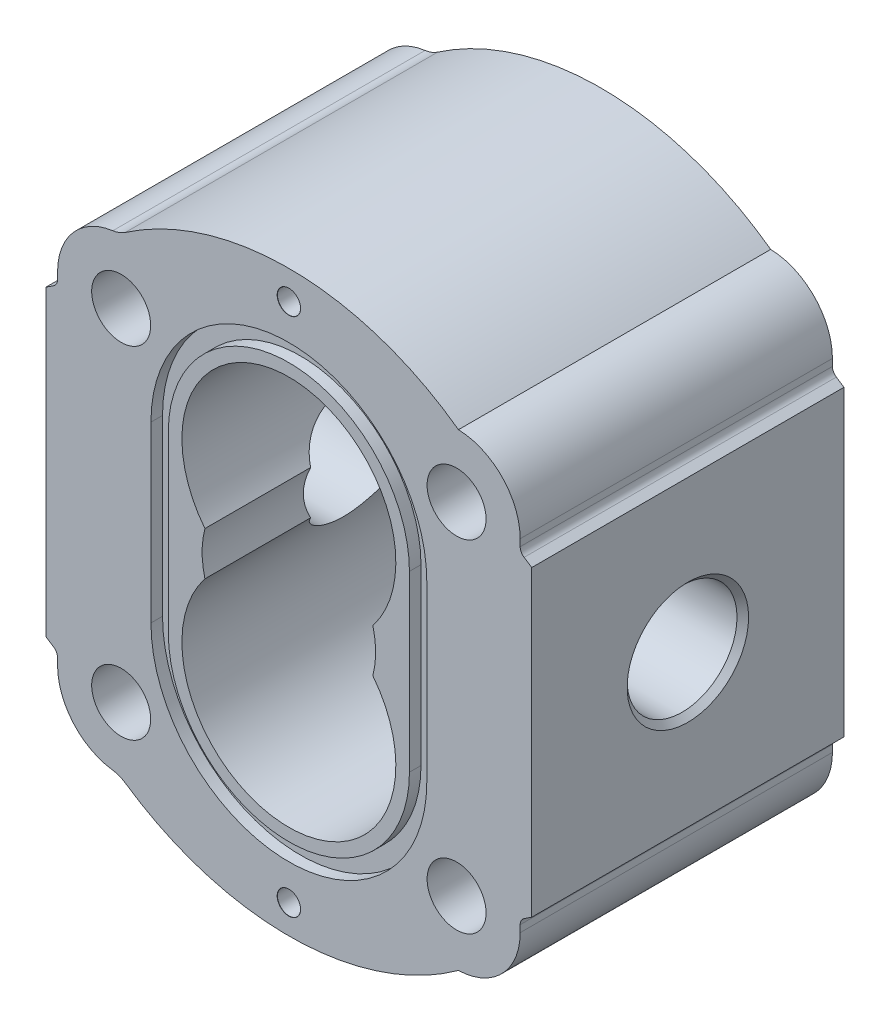
from build123d import *

# Parameters (mm, degrees)
IZIM1_R                       = 5.1
Y_KSEKLIK_EKSTR_ZYON1_DEPTH   = 27
KES_EKSTR_ZYON2_DEPTH         = 2
G1_2_DI_LI_DELIK1_D           = 19
G1_2_DI_LI_DELIK1_DEPTH       = 47.35
G1_2_DI_LI_DELIK1_CSINK_D     = 21.005
G1_2_DI_LI_DELIK1_CSINK_ANGLE = 90
G1_2_DI_LI_DELIK1_TIP         = 5.708175881
G1_2_DI_LI_DELIK2_D           = 19
G1_2_DI_LI_DELIK2_DEPTH       = 37.35
G1_2_DI_LI_DELIK2_CSINK_D     = 21.005
G1_2_DI_LI_DELIK2_CSINK_ANGLE = 90
G1_2_DI_LI_DELIK2_TIP         = 5.708175881
F_4_0_4_AP_DELIK1_AT_2_COUNT  = 2
F_4_0_4_AP_DELIK1_AT_2_PITCH  = 90
KES_EKSTR_ZYON3_DEPTH         = 2


with BuildPart() as part:
    # Çizim1 → Yükseklik-Ekstrüzyon1 (new, symmetric)
    with BuildSketch(Plane.XY):
        with BuildLine():
            ThreePointArc((-30.445342697, 40.404631332), (-37.273414339, 36.74918031), (-40, 29.5))
            Line((-40, 29.5), (-40, 28.305972781))
            ThreePointArc((-40, 28.305972781), (-40.180221035, 27.593102888), (-40.677577979, 27.051531862))
            Line((-40.677577979, 27.051531862), (-42, 26.184540858))
            Line((-42, 26.184540858), (-42, -26.184540858))
            Line((-42, -26.184540858), (-40.677577979, -27.051531862))
            ThreePointArc((-40.677577979, -27.051531862), (-40.180221035, -27.593102888), (-40, -28.305972781))
            Line((-40, -28.305972781), (-40, -29.5))
            ThreePointArc((-40, -29.5), (-37.273414339, -36.74918031), (-30.445342697, -40.404631332))
            ThreePointArc((-30.445342697, -40.404631332), (-29.311006992, -40.693176357), (-28.274833318, -41.237529034))
            ThreePointArc((-28.274833318, -41.237529034), (0, -50), (28.274833318, -41.237529034))
            ThreePointArc((28.274833318, -41.237529034), (28.803938458, -40.86970919), (29.328259336, -40.495100991))
            ThreePointArc((29.328259336, -40.495100991), (29.887953959, -40.464102233), (30.445342697, -40.404631332))
            ThreePointArc((30.445342697, -40.404631332), (37.273414339, -36.74918031), (40, -29.5))
            Line((40, -29.5), (40, -28.305972781))
            ThreePointArc((40, -28.305972781), (40.180221035, -27.593102888), (40.677577979, -27.051531862))
            Line((40.677577979, -27.051531862), (42, -26.184540858))
            Line((42, -26.184540858), (42, 26.184540858))
            Line((42, 26.184540858), (40.677577979, 27.051531862))
            ThreePointArc((40.677577979, 27.051531862), (40.180221035, 27.593102888), (40, 28.305972781))
            Line((40, 28.305972781), (40, 29.5))
            ThreePointArc((40, 29.5), (37.273414339, 36.74918031), (30.445342697, 40.404631332))
            ThreePointArc((30.445342697, 40.404631332), (29.887953959, 40.464102233), (29.328259336, 40.495100991))
            ThreePointArc((29.328259336, 40.495100991), (28.803938458, 40.86970919), (28.274833318, 41.237529034))
            ThreePointArc((28.274833318, 41.237529034), (0, 50), (-28.274833318, 41.237529034))
            ThreePointArc((-28.274833318, 41.237529034), (-29.311006992, 40.693176357), (-30.445342697, 40.404631332))
        make_face()
        with Locations((-29, -29.5)):
            Circle(IZIM1_R, mode=Mode.SUBTRACT)
        with Locations((29, -29.5)):
            Circle(IZIM1_R, mode=Mode.SUBTRACT)
        with Locations((-29, 29.5)):
            Circle(IZIM1_R, mode=Mode.SUBTRACT)
        with BuildLine():
            ThreePointArc((14.519627513, -3.765689429), (0, -33.73), (-14.519627513, -3.765689429))
            ThreePointArc((-14.519627513, -3.765689429), (-15, 0), (-14.519627513, 3.765689429))
            ThreePointArc((-14.519627513, 3.765689429), (0, 33.73), (14.519627513, 3.765689429))
            ThreePointArc((14.519627513, 3.765689429), (15, 0), (14.519627513, -3.765689429))
        make_face(mode=Mode.SUBTRACT)
        with Locations((29, 29.5)):
            Circle(IZIM1_R, mode=Mode.SUBTRACT)
    extrude(amount=Y_KSEKLIK_EKSTR_ZYON1_DEPTH, both=True)

    # Çizim2 → Kes-Ekstrüzyon2 (cut)
    with BuildSketch(Plane.XY.offset(27)):
        with BuildLine():
            Line((23.85, 15.04), (23.85, -15.04))
            ThreePointArc((23.85, -15.04), (0, -38.89), (-23.85, -15.04))
            Line((-23.85, -15.04), (-23.85, 15.04))
            ThreePointArc((-23.85, 15.04), (0, 38.89), (23.85, 15.04))
        make_face()
        with BuildLine():
            Line((-20.85, 15.04), (-20.85, -15.04))
            ThreePointArc((-20.85, -15.04), (0, -35.89), (20.85, -15.04))
            Line((20.85, -15.04), (20.85, 15.04))
            ThreePointArc((20.85, 15.04), (0, 35.89), (-20.85, 15.04))
        make_face(mode=Mode.SUBTRACT)
    kes_ekstr_zyon2 = extrude(amount=-KES_EKSTR_ZYON2_DEPTH, mode=Mode.SUBTRACT)

    # Aynalama1: Kes-Ekstrüzyon2 across plane
    add(kes_ekstr_zyon2.mirror(Plane.XY), mode=Mode.SUBTRACT)

    # G1/2 Dişli Delik1
    with Locations(Plane(origin=(42, 0, 0), x_dir=(0, 0, -1), z_dir=(1, 0, 0))):
        with Locations((0, 0)):
            CounterSinkHole(G1_2_DI_LI_DELIK1_D / 2, G1_2_DI_LI_DELIK1_CSINK_D / 2, depth=G1_2_DI_LI_DELIK1_DEPTH, counter_sink_angle=G1_2_DI_LI_DELIK1_CSINK_ANGLE)
            with Locations((0, 0, -(G1_2_DI_LI_DELIK1_DEPTH + G1_2_DI_LI_DELIK1_TIP / 2))):  # 118° drill point
                Cone(0, G1_2_DI_LI_DELIK1_D / 2, G1_2_DI_LI_DELIK1_TIP, mode=Mode.SUBTRACT)

    # G1/2 Dişli Delik2
    with Locations(Plane.ZY.offset(42)):
        with Locations((0, 0)):
            CounterSinkHole(G1_2_DI_LI_DELIK2_D / 2, G1_2_DI_LI_DELIK2_CSINK_D / 2, depth=G1_2_DI_LI_DELIK2_DEPTH, counter_sink_angle=G1_2_DI_LI_DELIK2_CSINK_ANGLE)
            with Locations((0, 0, -(G1_2_DI_LI_DELIK2_DEPTH + G1_2_DI_LI_DELIK2_TIP / 2))):  # 118° drill point
                Cone(0, G1_2_DI_LI_DELIK2_D / 2, G1_2_DI_LI_DELIK2_TIP, mode=Mode.SUBTRACT)

    # Çizim13 → Ø4.0 (4) Çap Delik1 (revolve, cut)
    with BuildSketch(Plane(origin=(0, 45, -27), x_dir=(0, 1, 0), z_dir=(1, 0, 0))):
        Polygon((0, 0), (0, 4.201721238), (2, 3), (2, 0.025), (2.025, 0), align=None)
    f_4_0_4_ap_delik1 = revolve(axis=Axis((0, 45, -33.35), (0, 0, 1)), mode=Mode.SUBTRACT)

    # Ø4.0 (4) Çap Delik1 at 2: Ø4.0 (4) Çap Delik1 ×2
    with Locations(*[(0, -i * F_4_0_4_AP_DELIK1_AT_2_PITCH, 0) for i in range(1, F_4_0_4_AP_DELIK1_AT_2_COUNT)]):
        add(f_4_0_4_ap_delik1, mode=Mode.SUBTRACT)

    # Aynalama2: Ø4.0 (4) Çap Delik1 across plane
    add(f_4_0_4_ap_delik1.mirror(Plane.XY), mode=Mode.SUBTRACT)

    # Aynalama2 copy 1 sketch → Aynalama2 copy 1 (revolve, cut)
    with BuildSketch(Plane(origin=(0, -45, 27), x_dir=(0, 1, 0), z_dir=(1, 0, 0))):
        Polygon((0, 0), (0, -4.201721238), (2, -3), (2, -0.025), (2.025, 0), align=None)
    revolve(axis=Axis((0, -45, 33.35), (0, 0, 1)), mode=Mode.SUBTRACT)

    # Çizim14 → Kes-Ekstrüzyon3 (cut)
    # profile 1 of 12: a face of its own
    with BuildSketch(Plane.ZY.offset(42)):
        Polygon((-18.742783617, 22.525062983), (-18.404842912, 22.525062983), (-17.537555251, 20.566128688), (-16.659049642, 22.525062983), (-16.319706694, 22.525062983), (-17.890219514, 19.025062983), (-18.229562463, 19.025062983), (-17.707226726, 20.186821797), align=None)
    # profile 2 of 12: a face of its own
    with BuildSketch(Plane.ZY.offset(42)):
        with BuildLine():
            Line((-15.960732335, 22.525062983), (-15.646629771, 22.525062983))
            Line((-15.646629771, 22.525062983), (-15.646629771, 21.338764906))
            add(Edge.make_bspline(
                [(-15.646629771, 21.338764906), (-15.646487866, 21.303942157), (-15.646216408, 21.237327869), (-15.644375467, 21.141472682), (-15.640045374, 21.054055969), (-15.634631549, 20.975027232), (-15.627669413, 20.904399841), (-15.619386053, 20.842420484), (-15.610127631, 20.7883863), (-15.601064917, 20.755842944), (-15.596850123, 20.740708015)],
                knots=[0, 0, 0, 0, 1.388932606, 2.656963016, 3.823490214, 4.879454478, 5.816252168, 6.653371382, 7.373723809, 8, 8, 8, 8], degree=3))
            add(Edge.make_bspline(
                [(-15.596850123, 20.740708015), (-15.590088668, 20.721685144), (-15.576706327, 20.684034883), (-15.552432843, 20.629645877), (-15.522404507, 20.579270595), (-15.489544679, 20.530966522), (-15.451645271, 20.486164535), (-15.4091858, 20.444940292), (-15.363587563, 20.405736201), (-15.29583254, 20.359351409), (-15.203173274, 20.309636078), (-15.081520518, 20.26674026), (-14.949616293, 20.24110444), (-14.858451573, 20.238130185), (-14.811593713, 20.236601444)],
                knots=[0, 0, 0, 0, 0.725840625, 1.436591201, 2.137033971, 2.831655856, 3.53531722, 4.242432219, 4.957935707, 5.694543706, 7.190802206, 8.724350549, 10.316345118, 12, 12, 12, 12], degree=3))
            add(Edge.make_bspline(
                [(-14.811593713, 20.236601444), (-14.764740205, 20.238162693), (-14.674087337, 20.24118342), (-14.543632368, 20.265966959), (-14.424380953, 20.307372648), (-14.317530002, 20.365180059), (-14.223564162, 20.435922122), (-14.145259743, 20.518930931), (-14.080652488, 20.611580318), (-14.052443068, 20.680704597), (-14.038256373, 20.71546763)],
                knots=[0, 0, 0, 0, 1.157059328, 2.238695713, 3.266970494, 4.264342957, 5.228770407, 6.160125903, 7.074715775, 8, 8, 8, 8], degree=3))
            add(Edge.make_bspline(
                [(-14.038256373, 20.71546763), (-14.034062143, 20.729433929), (-14.024789725, 20.760310004), (-14.014827373, 20.812689753), (-14.005852912, 20.875154357), (-13.998189735, 20.948112566), (-13.992724573, 21.031373718), (-13.989778546, 21.124911794), (-13.986450271, 21.228433155), (-13.986399755, 21.300900914), (-13.98637336, 21.338764906)],
                knots=[0, 0, 0, 0, 0.557542046, 1.232589297, 2.036731608, 2.971723315, 4.038036528, 5.22795436, 6.551621927, 8, 8, 8, 8], degree=3))
            Line((-13.98637336, 21.338764906), (-13.98637336, 22.525062983))
            Line((-13.98637336, 22.525062983), (-13.672270796, 22.525062983))
            Line((-13.672270796, 22.525062983), (-13.672270796, 21.279870675))
            add(Edge.make_bspline(
                [(-13.672270796, 21.279870675), (-13.672712491, 21.237563504), (-13.673569439, 21.155481804), (-13.679076783, 21.036197692), (-13.688526396, 20.925035447), (-13.702869081, 20.821936227), (-13.719734755, 20.726978746), (-13.741491028, 20.6400413), (-13.767469266, 20.561391746), (-13.796774781, 20.489649969), (-13.831396648, 20.424603075), (-13.868223669, 20.362867258), (-13.910748441, 20.305974323), (-13.955518675, 20.251092186), (-14.005320331, 20.200950658), (-14.05922019, 20.154399182), (-14.11645961, 20.110726151), (-14.178308808, 20.071634871), (-14.243864871, 20.036418226), (-14.313208728, 20.005202148), (-14.387189726, 19.980499571), (-14.464853363, 19.959188905), (-14.546580142, 19.942474436), (-14.632291275, 19.930687869), (-14.721957891, 19.923462538), (-14.783067351, 19.922825493), (-14.8143982, 19.92249888)],
                knots=[0, 0, 0, 0, 1.493040784, 2.896703357, 4.213163133, 5.428574705, 6.569057535, 7.615249723, 8.588095153, 9.490268104, 10.346124644, 11.18633936, 12.024365274, 12.850166724, 13.684164916, 14.514361689, 15.362232829, 16.222528818, 17.093394965, 17.986930858, 18.902426812, 19.842810585, 20.827885679, 21.843828298, 22.894529745, 24, 24, 24, 24], degree=3))
            add(Edge.make_bspline(
                [(-14.8143982, 19.92249888), (-14.845494714, 19.922838587), (-14.906602259, 19.923506143), (-14.996273504, 19.930647951), (-15.08222211, 19.942456122), (-15.164142508, 19.959311339), (-15.242116906, 19.980350409), (-15.316461145, 20.005353945), (-15.386304709, 20.036434426), (-15.452486712, 20.071411984), (-15.514489101, 20.110977259), (-15.572597679, 20.154345299), (-15.626734531, 20.201451362), (-15.676911599, 20.252098719), (-15.722424576, 20.306915655), (-15.763840618, 20.365461216), (-15.801797323, 20.427155304), (-15.836150113, 20.493218467), (-15.865661869, 20.565790477), (-15.891717115, 20.646087574), (-15.913027753, 20.73499009), (-15.930370221, 20.832422019), (-15.944321662, 20.93791706), (-15.954007804, 21.052085476), (-15.959423635, 21.174649168), (-15.960286696, 21.259299058), (-15.960732335, 21.303007694)],
                knots=[0, 0, 0, 0, 1.083640291, 2.129454052, 3.13281866, 4.105697902, 5.042300162, 5.946461698, 6.836384745, 7.703652036, 8.553297018, 9.397182691, 10.228592656, 11.052265423, 11.879314572, 12.708807002, 13.549817954, 14.402308542, 15.300838682, 16.27712199, 17.341985831, 18.484375296, 19.725102775, 21.0496083, 22.476576903, 24, 24, 24, 24], degree=3))
            Line((-15.960732335, 21.303007694), (-15.960732335, 22.525062983))
        make_face()
    # profile 3 of 12: a face of its own
    with BuildSketch(Plane.ZY.offset(42)):
        with BuildLine():
            Line((-11.742783617, 22.206052566), (-11.955924642, 21.986601444))
            add(Edge.make_bspline(
                [(-11.955924642, 21.986601444), (-11.974315146, 22.007914591), (-12.009769872, 22.049003828), (-12.066001353, 22.103940894), (-12.122024956, 22.150077833), (-12.17707377, 22.189030092), (-12.232532039, 22.218479239), (-12.287748957, 22.239974101), (-12.342781696, 22.253275906), (-12.379567731, 22.254990345), (-12.397631373, 22.255832213)],
                knots=[0, 0, 0, 0, 1.26578478, 2.440284043, 3.530471711, 4.527705817, 5.468200915, 6.346673037, 7.188140097, 8, 8, 8, 8], degree=3))
            add(Edge.make_bspline(
                [(-12.397631373, 22.255832213), (-12.419770763, 22.25475734), (-12.463337949, 22.252642143), (-12.525763767, 22.231528712), (-12.583714392, 22.199119974), (-12.633871372, 22.15315139), (-12.676359052, 22.100387121), (-12.707372733, 22.041390797), (-12.726338717, 21.977942753), (-12.728743449, 21.933912895), (-12.729963104, 21.911581412)],
                knots=[0, 0, 0, 0, 0.99966794, 1.967205029, 2.953328237, 3.988086729, 5.028030931, 6.008226631, 6.989793394, 8, 8, 8, 8], degree=3))
            add(Edge.make_bspline(
                [(-12.729963104, 21.911581412), (-12.728852292, 21.891369368), (-12.726633798, 21.851002257), (-12.709387119, 21.791454223), (-12.681921047, 21.733397185), (-12.656250853, 21.697834279), (-12.643024001, 21.679510098)],
                knots=[0, 0, 0, 0, 0.960159726, 1.917612774, 2.927026955, 4, 4, 4, 4], degree=3))
            add(Edge.make_bspline(
                [(-12.643024001, 21.679510098), (-12.635060508, 21.669725514), (-12.618111215, 21.648900259), (-12.5863027, 21.619996406), (-12.550280197, 21.588054155), (-12.506960259, 21.556117318), (-12.458209231, 21.522485593), (-12.402969947, 21.48848346), (-12.342995442, 21.451519035), (-12.300058136, 21.428074599), (-12.277739546, 21.415888303)],
                knots=[0, 0, 0, 0, 0.66740084, 1.420478572, 2.27185888, 3.217733974, 4.268547843, 5.408967954, 6.65319498, 8, 8, 8, 8], degree=3))
            add(Edge.make_bspline(
                [(-12.277739546, 21.415888303), (-12.250525969, 21.4006434), (-12.197958299, 21.371195268), (-12.123265532, 21.325485564), (-12.055478491, 21.28005414), (-11.994022823, 21.235386866), (-11.940081014, 21.190233999), (-11.892016462, 21.146326242), (-11.851028018, 21.102336933), (-11.828074091, 21.07160382), (-11.817102527, 21.056913944)],
                knots=[0, 0, 0, 0, 1.27191281, 2.456916733, 3.569705269, 4.599008579, 5.553216877, 6.436649441, 7.252746552, 8, 8, 8, 8], degree=3))
            add(Edge.make_bspline(
                [(-11.817102527, 21.056913944), (-11.798892, 21.027247856), (-11.76264967, 20.968206835), (-11.724591404, 20.870988408), (-11.702531129, 20.767877905), (-11.699468909, 20.697345685), (-11.697911822, 20.661481252)],
                knots=[0, 0, 0, 0, 0.995354457, 1.980940102, 2.973342416, 4, 4, 4, 4], degree=3))
            add(Edge.make_bspline(
                [(-11.697911822, 20.661481252), (-11.698631356, 20.636212106), (-11.700049276, 20.586416493), (-11.709907343, 20.513081663), (-11.726862319, 20.442947105), (-11.749956073, 20.375251821), (-11.781140446, 20.311292881), (-11.817688243, 20.249456632), (-11.861563155, 20.191080701), (-11.91165453, 20.136241741), (-11.966500024, 20.086155994), (-12.025006163, 20.04213204), (-12.087244993, 20.005557703), (-12.152771795, 19.975292357), (-12.221735449, 19.951224099), (-12.294146738, 19.934561568), (-12.369775493, 19.924588807), (-12.421205301, 19.923204331), (-12.447411021, 19.92249888)],
                knots=[0, 0, 0, 0, 1.032770009, 2.035186124, 3.017557409, 3.978232242, 4.952395191, 5.920591857, 6.910227898, 7.931268572, 8.952309245, 9.941945286, 10.918353717, 11.897095711, 12.887975737, 13.898235213, 14.929059601, 16, 16, 16, 16], degree=3))
            add(Edge.make_bspline(
                [(-12.447411021, 19.92249888), (-12.482778196, 19.92349158), (-12.553021123, 19.925463188), (-12.656910842, 19.943969249), (-12.758431601, 19.972764643), (-12.856815141, 20.012480577), (-12.949861255, 20.06263129), (-13.03499218, 20.122693683), (-13.112503642, 20.190683681), (-13.156621916, 20.242796591), (-13.178681053, 20.268853047)],
                knots=[0, 0, 0, 0, 1.013940152, 2.01379169, 3.017749504, 4.037548394, 5.051665909, 6.043208538, 7.021604269, 8, 8, 8, 8], degree=3))
            Line((-13.178681053, 20.268853047), (-12.97044788, 20.505832213))
            add(Edge.make_bspline(
                [(-12.97044788, 20.505832213), (-12.950675467, 20.484477449), (-12.912343654, 20.443078009), (-12.851042438, 20.387953668), (-12.788663036, 20.341752397), (-12.72582835, 20.303108982), (-12.661608256, 20.273333579), (-12.596362641, 20.252414985), (-12.530224217, 20.238970793), (-12.485802081, 20.237392511), (-12.463536822, 20.236601444)],
                knots=[0, 0, 0, 0, 1.179806542, 2.287233372, 3.337373186, 4.324005949, 5.273901747, 6.200048787, 7.097828587, 8, 8, 8, 8], degree=3))
            add(Edge.make_bspline(
                [(-12.463536822, 20.236601444), (-12.433218896, 20.237972269), (-12.373982754, 20.240650631), (-12.289138996, 20.264967723), (-12.210800369, 20.303097675), (-12.142777024, 20.357182373), (-12.084874863, 20.420137946), (-12.042946688, 20.491052065), (-12.016670513, 20.567843522), (-12.013584514, 20.621075824), (-12.012014386, 20.648159938)],
                knots=[0, 0, 0, 0, 1.072336372, 2.095165389, 3.102688358, 4.141489647, 5.156069229, 6.117746104, 7.042326257, 8, 8, 8, 8], degree=3))
            add(Edge.make_bspline(
                [(-12.012014386, 20.648159938), (-12.01310068, 20.670469556), (-12.015245423, 20.714516912), (-12.032088695, 20.778267253), (-12.058701547, 20.838736534), (-12.084906196, 20.874126181), (-12.098252367, 20.892150322)],
                knots=[0, 0, 0, 0, 1.013901739, 2.00181326, 2.98231254, 4, 4, 4, 4], degree=3))
            add(Edge.make_bspline(
                [(-12.098252367, 20.892150322), (-12.106274761, 20.901185685), (-12.123750434, 20.920867967), (-12.155805675, 20.949293045), (-12.194187537, 20.979931145), (-12.2393277, 21.012262734), (-12.291317162, 21.045861339), (-12.350366637, 21.080550691), (-12.41566719, 21.117978417), (-12.461837821, 21.142798072), (-12.485972719, 21.155772117)],
                knots=[0, 0, 0, 0, 0.615000592, 1.339693406, 2.178160186, 3.116406724, 4.166410947, 5.330106347, 6.604359322, 8, 8, 8, 8], degree=3))
            add(Edge.make_bspline(
                [(-12.485972719, 21.155772117), (-12.512019359, 21.170311249), (-12.562532107, 21.198507265), (-12.634079398, 21.242423346), (-12.698626752, 21.28709062), (-12.757727327, 21.330003459), (-12.809888332, 21.373424403), (-12.854904281, 21.417401655), (-12.894547496, 21.460161641), (-12.916494908, 21.490458938), (-12.926978328, 21.504930771)],
                knots=[0, 0, 0, 0, 1.262093308, 2.447601706, 3.550203992, 4.582594899, 5.537233252, 6.418365656, 7.244515135, 8, 8, 8, 8], degree=3))
            add(Edge.make_bspline(
                [(-12.926978328, 21.504930771), (-12.945108928, 21.534076386), (-12.981376463, 21.592377801), (-13.016591654, 21.689688278), (-13.040797683, 21.792133336), (-13.042960073, 21.86282019), (-13.044065668, 21.89896122)],
                knots=[0, 0, 0, 0, 0.985009483, 1.970363186, 2.962279964, 4, 4, 4, 4], degree=3))
            add(Edge.make_bspline(
                [(-13.044065668, 21.89896122), (-13.043531473, 21.922586618), (-13.042485977, 21.968824869), (-13.034141925, 22.036763689), (-13.018950214, 22.101311843), (-12.999895291, 22.163438706), (-12.973412287, 22.2219408), (-12.941766382, 22.277598271), (-12.904578957, 22.330334189), (-12.861735666, 22.379337321), (-12.814629021, 22.423846647), (-12.763734251, 22.462645275), (-12.710195994, 22.49575163), (-12.653787575, 22.523516791), (-12.593967102, 22.544518173), (-12.531152716, 22.558975558), (-12.465471561, 22.568630761), (-12.420570435, 22.569493846), (-12.397631373, 22.569934778)],
                knots=[0, 0, 0, 0, 1.087655834, 2.128696564, 3.144119009, 4.137814668, 5.115653402, 6.093965665, 7.082169637, 8.081268856, 9.086088321, 10.061021666, 11.022561449, 11.980240094, 12.950172527, 13.934149372, 14.944599409, 16, 16, 16, 16], degree=3))
            add(Edge.make_bspline(
                [(-12.397631373, 22.569934778), (-12.37043931, 22.568830437), (-12.315545088, 22.566601039), (-12.233190462, 22.548895349), (-12.15095712, 22.519762244), (-12.06863377, 22.479526011), (-11.98682348, 22.427459135), (-11.904806624, 22.364529836), (-11.821598593, 22.291152121), (-11.76964228, 22.235052896), (-11.742783617, 22.206052566)],
                knots=[0, 0, 0, 0, 0.845714091, 1.707292901, 2.609013841, 3.555613372, 4.552488639, 5.621697636, 6.770543573, 8, 8, 8, 8], degree=3))
        make_face()
    # profile 4 of 12: a face of its own
    with BuildSketch(Plane.ZY.offset(42)):
        with BuildLine():
            Line((-11.114578489, 22.525062983), (-10.800475924, 22.525062983))
            Line((-10.800475924, 22.525062983), (-10.800475924, 21.338764906))
            add(Edge.make_bspline(
                [(-10.800475924, 21.338764906), (-10.80033402, 21.303942157), (-10.800062562, 21.237327869), (-10.798221621, 21.141472682), (-10.793891528, 21.054055969), (-10.788477703, 20.975027232), (-10.781515567, 20.904399841), (-10.773232206, 20.842420484), (-10.763973785, 20.7883863), (-10.754911071, 20.755842944), (-10.750696277, 20.740708015)],
                knots=[0, 0, 0, 0, 1.388932606, 2.656963016, 3.823490214, 4.879454478, 5.816252168, 6.653371382, 7.373723809, 8, 8, 8, 8], degree=3))
            add(Edge.make_bspline(
                [(-10.750696277, 20.740708015), (-10.743934822, 20.721685144), (-10.730552481, 20.684034883), (-10.706278997, 20.629645877), (-10.676250661, 20.579270595), (-10.643390833, 20.530966522), (-10.605491425, 20.486164535), (-10.563031954, 20.444940292), (-10.517433717, 20.405736201), (-10.449678694, 20.359351409), (-10.357019428, 20.309636078), (-10.235366672, 20.26674026), (-10.103462446, 20.24110444), (-10.012297727, 20.238130185), (-9.965439867, 20.236601444)],
                knots=[0, 0, 0, 0, 0.725840625, 1.436591201, 2.137033971, 2.831655856, 3.53531722, 4.242432219, 4.957935707, 5.694543706, 7.190802206, 8.724350549, 10.316345118, 12, 12, 12, 12], degree=3))
            add(Edge.make_bspline(
                [(-9.965439867, 20.236601444), (-9.918586359, 20.238162693), (-9.827933491, 20.24118342), (-9.697478521, 20.265966959), (-9.578227107, 20.307372648), (-9.471376156, 20.365180059), (-9.377410316, 20.435922122), (-9.299105897, 20.518930931), (-9.234498642, 20.611580318), (-9.206289222, 20.680704597), (-9.192102527, 20.71546763)],
                knots=[0, 0, 0, 0, 1.157059328, 2.238695713, 3.266970494, 4.264342957, 5.228770407, 6.160125903, 7.074715775, 8, 8, 8, 8], degree=3))
            add(Edge.make_bspline(
                [(-9.192102527, 20.71546763), (-9.187908297, 20.729433929), (-9.178635879, 20.760310004), (-9.168673527, 20.812689753), (-9.159699065, 20.875154357), (-9.152035889, 20.948112566), (-9.146570727, 21.031373718), (-9.1436247, 21.124911794), (-9.140296425, 21.228433155), (-9.140245909, 21.300900914), (-9.140219514, 21.338764906)],
                knots=[0, 0, 0, 0, 0.557542046, 1.232589297, 2.036731608, 2.971723315, 4.038036528, 5.22795436, 6.551621927, 8, 8, 8, 8], degree=3))
            Line((-9.140219514, 21.338764906), (-9.140219514, 22.525062983))
            Line((-9.140219514, 22.525062983), (-8.82611695, 22.525062983))
            Line((-8.82611695, 22.525062983), (-8.82611695, 21.279870675))
            add(Edge.make_bspline(
                [(-8.82611695, 21.279870675), (-8.826558645, 21.237563504), (-8.827415593, 21.155481804), (-8.832922937, 21.036197692), (-8.842372549, 20.925035447), (-8.856715234, 20.821936227), (-8.873580909, 20.726978746), (-8.895337182, 20.6400413), (-8.92131542, 20.561391746), (-8.950620935, 20.489649969), (-8.985242802, 20.424603075), (-9.022069823, 20.362867258), (-9.064594595, 20.305974323), (-9.109364829, 20.251092186), (-9.159166485, 20.200950658), (-9.213066344, 20.154399182), (-9.270305763, 20.110726151), (-9.332154961, 20.071634871), (-9.397711024, 20.036418226), (-9.467054881, 20.005202148), (-9.54103588, 19.980499571), (-9.618699517, 19.959188905), (-9.700426296, 19.942474436), (-9.786137429, 19.930687869), (-9.875804045, 19.923462538), (-9.936913505, 19.922825493), (-9.968244354, 19.92249888)],
                knots=[0, 0, 0, 0, 1.493040784, 2.896703357, 4.213163133, 5.428574705, 6.569057535, 7.615249723, 8.588095153, 9.490268104, 10.346124644, 11.18633936, 12.024365274, 12.850166724, 13.684164916, 14.514361689, 15.362232829, 16.222528818, 17.093394965, 17.986930858, 18.902426812, 19.842810585, 20.827885679, 21.843828298, 22.894529745, 24, 24, 24, 24], degree=3))
            add(Edge.make_bspline(
                [(-9.968244354, 19.92249888), (-9.999340868, 19.922838587), (-10.060448413, 19.923506143), (-10.150119657, 19.930647951), (-10.236068264, 19.942456122), (-10.317988662, 19.959311339), (-10.395963059, 19.980350409), (-10.470307299, 20.005353945), (-10.540150862, 20.036434426), (-10.606332866, 20.071411984), (-10.668335255, 20.110977259), (-10.726443833, 20.154345299), (-10.780580685, 20.201451362), (-10.830757753, 20.252098719), (-10.87627073, 20.306915655), (-10.917686771, 20.365461216), (-10.955643477, 20.427155304), (-10.989996267, 20.493218467), (-11.019508023, 20.565790477), (-11.045563268, 20.646087574), (-11.066873907, 20.73499009), (-11.084216375, 20.832422019), (-11.098167816, 20.93791706), (-11.107853958, 21.052085476), (-11.113269789, 21.174649168), (-11.11413285, 21.259299058), (-11.114578489, 21.303007694)],
                knots=[0, 0, 0, 0, 1.083640291, 2.129454052, 3.13281866, 4.105697902, 5.042300162, 5.946461698, 6.836384745, 7.703652036, 8.553297018, 9.397182691, 10.228592656, 11.052265423, 11.879314572, 12.708807002, 13.549817954, 14.402308542, 15.300838682, 16.27712199, 17.341985831, 18.484375296, 19.725102775, 21.0496083, 22.476576903, 24, 24, 24, 24], degree=3))
            Line((-11.114578489, 21.303007694), (-11.114578489, 22.525062983))
        make_face()
    # profile 5 of 12: a face of its own
    with BuildSketch(Plane.ZY.offset(42)):
        with BuildLine():
            Line((-7.031245155, 23.536080611), (-7.031245155, 23.209357854))
            add(Edge.make_bspline(
                [(-7.031245155, 23.209357854), (-7.060983934, 23.221308727), (-7.117428755, 23.243991731), (-7.200669131, 23.268656356), (-7.277197965, 23.284592096), (-7.326351855, 23.286828041), (-7.34955445, 23.287883496)],
                knots=[0, 0, 0, 0, 1.16548392, 2.212112691, 3.15604595, 4, 4, 4, 4], degree=3))
            add(Edge.make_bspline(
                [(-7.34955445, 23.287883496), (-7.365228214, 23.287232155), (-7.395567393, 23.285971378), (-7.43917072, 23.279543102), (-7.47845993, 23.266440301), (-7.51336555, 23.249411025), (-7.54231601, 23.228056841), (-7.567102235, 23.206601577), (-7.585068764, 23.182416397), (-7.594823712, 23.159895986), (-7.600773713, 23.139044993), (-7.602563841, 23.117690727), (-7.606948755, 23.091466641), (-7.608171562, 23.059302923), (-7.61095893, 23.022200212), (-7.610712289, 22.979373316), (-7.612996212, 22.931496173), (-7.612654298, 22.897595624), (-7.612475123, 22.879830611)],
                knots=[0, 0, 0, 0, 1.311993654, 2.539582093, 3.670788641, 4.763509788, 5.772417512, 6.671800701, 7.496729179, 8.266799162, 8.712543678, 9.304149002, 10.05334463, 10.934920737, 11.99209668, 13.165090968, 14.514413552, 16, 16, 16, 16], degree=3))
            Line((-7.612475123, 22.879830611), (-7.612475123, 22.525062983))
            Line((-7.612475123, 22.525062983), (-7.07611695, 22.525062983))
            Line((-7.07611695, 22.525062983), (-7.07611695, 22.210960419))
            Line((-7.07611695, 22.210960419), (-7.613176245, 22.210960419))
            Line((-7.613176245, 22.210960419), (-7.614578489, 19.967370675))
            Line((-7.614578489, 19.967370675), (-7.928681053, 19.967370675))
            Line((-7.928681053, 19.967370675), (-7.928681053, 22.210960419))
            Line((-7.928681053, 22.210960419), (-8.287655412, 22.210960419))
            Line((-8.287655412, 22.210960419), (-8.287655412, 22.525062983))
            Line((-8.287655412, 22.525062983), (-7.928681053, 22.525062983))
            Line((-7.928681053, 22.525062983), (-7.928681053, 22.933816989))
            add(Edge.make_bspline(
                [(-7.928681053, 22.933816989), (-7.928655838, 22.956492569), (-7.928607467, 22.999993473), (-7.925219616, 23.062602914), (-7.922323896, 23.120426378), (-7.916556268, 23.173015011), (-7.909894562, 23.220861154), (-7.900358402, 23.263254035), (-7.891347031, 23.301335794), (-7.874998439, 23.344438451), (-7.85057622, 23.393288475), (-7.811046023, 23.444912375), (-7.763653016, 23.491217322), (-7.707044692, 23.530224675), (-7.643329157, 23.562640153), (-7.572447979, 23.585882006), (-7.495172781, 23.599022451), (-7.441685311, 23.60097666), (-7.414057655, 23.60198606)],
                knots=[0, 0, 0, 0, 1.116398763, 2.141702935, 3.087165306, 3.966655413, 4.746276475, 5.464069668, 6.106083417, 6.67047701, 7.730773247, 8.782666744, 9.856985883, 10.980834087, 12.154321827, 13.366232824, 14.639591414, 16, 16, 16, 16], degree=3))
            add(Edge.make_bspline(
                [(-7.414057655, 23.60198606), (-7.385980897, 23.601028679), (-7.327035233, 23.599018709), (-7.23483863, 23.586585302), (-7.135242113, 23.565114272), (-7.066906192, 23.546036387), (-7.031245155, 23.536080611)],
                knots=[0, 0, 0, 0, 0.864728408, 1.815451418, 2.859995356, 4, 4, 4, 4], degree=3))
        make_face()
    # profile 6 of 12: a face of its own
    with BuildSketch(Plane.ZY.offset(42)):
        with BuildLine():
            Line((-5.23637336, 19.967370675), (-5.23637336, 23.557114265))
            Line((-5.23637336, 23.557114265), (-4.922270796, 23.557114265))
            Line((-4.922270796, 23.557114265), (-4.922270796, 22.060920354))
            add(Edge.make_bspline(
                [(-4.922270796, 22.060920354), (-4.886877377, 22.101678286), (-4.817823358, 22.181198692), (-4.702046907, 22.285046341), (-4.580641337, 22.373098819), (-4.452683081, 22.445684937), (-4.317990148, 22.500958544), (-4.177258039, 22.541380934), (-4.030126999, 22.565767837), (-3.929807825, 22.56853391), (-3.879001565, 22.569934778)],
                knots=[0, 0, 0, 0, 1.077089805, 2.101446609, 3.097517232, 4.067117542, 5.031729543, 5.997785507, 6.985986182, 8, 8, 8, 8], degree=3))
            add(Edge.make_bspline(
                [(-3.879001565, 22.569934778), (-3.833835428, 22.568694549), (-3.744534276, 22.566242407), (-3.613252129, 22.547607912), (-3.486938853, 22.51739011), (-3.365663206, 22.47549793), (-3.249991073, 22.419914953), (-3.138932016, 22.353373645), (-3.033055032, 22.274135316), (-2.934000146, 22.183537005), (-2.84270626, 22.085180383), (-2.76279375, 21.980000067), (-2.695294054, 21.869524977), (-2.639462761, 21.754124914), (-2.596291708, 21.633328563), (-2.566549441, 21.507254365), (-2.547655977, 21.376026346), (-2.54527573, 21.286713543), (-2.544065668, 21.241308976)],
                knots=[0, 0, 0, 0, 1.034377878, 2.045141349, 3.03070803, 4.00595497, 4.978199603, 5.965204761, 6.967410914, 8.002051993, 9.036360596, 10.037508045, 11.022711142, 11.997267194, 12.969246472, 13.954813154, 14.960274251, 16, 16, 16, 16], degree=3))
            add(Edge.make_bspline(
                [(-2.544065668, 21.241308976), (-2.545302109, 21.196608959), (-2.547740174, 21.108467563), (-2.566361483, 20.978761007), (-2.597107747, 20.853922308), (-2.641068931, 20.734274051), (-2.696333869, 20.619254137), (-2.765445145, 20.510173733), (-2.845256144, 20.405134757), (-2.937587293, 20.307511126), (-3.037500846, 20.217277726), (-3.144415089, 20.138871861), (-3.25563701, 20.071154741), (-3.372900123, 20.017499293), (-3.494468164, 19.974098372), (-3.621643551, 19.943980681), (-3.753706779, 19.926407626), (-3.843425667, 19.923812059), (-3.888817271, 19.92249888)],
                knots=[0, 0, 0, 0, 1.024244038, 2.01964794, 2.996620209, 3.965911562, 4.936179293, 5.91563013, 6.920572822, 7.955171681, 8.990768464, 10.002129126, 10.989675881, 11.969873457, 12.952483066, 13.943799762, 14.959703725, 16, 16, 16, 16], degree=3))
            add(Edge.make_bspline(
                [(-3.888817271, 19.92249888), (-3.940782383, 19.923939488), (-4.042676907, 19.92676427), (-4.191729572, 19.950183249), (-4.332811122, 19.990044859), (-4.46752867, 20.043606615), (-4.593956393, 20.116135269), (-4.712896976, 20.206092019), (-4.823600348, 20.314959156), (-4.888817164, 20.398020646), (-4.922270796, 20.440627887)],
                knots=[0, 0, 0, 0, 1.035807596, 2.031038093, 2.998900396, 3.954262848, 4.914341711, 5.895762244, 6.92060972, 8, 8, 8, 8], degree=3))
            Line((-4.922270796, 20.440627887), (-4.922270796, 19.967370675))
            Line((-4.922270796, 19.967370675), (-5.23637336, 19.967370675))
        make_face()
        with BuildLine():
            add(Edge.make_bspline(
                [(-3.891621758, 20.236601444), (-3.845707405, 20.238235073), (-3.755079776, 20.241459597), (-3.622035986, 20.26663322), (-3.494721776, 20.308517334), (-3.373778694, 20.365801042), (-3.261099382, 20.437823077), (-3.160446748, 20.524969247), (-3.070967039, 20.624470762), (-2.996315263, 20.736704455), (-2.933989018, 20.856155424), (-2.891175742, 20.981809726), (-2.862456021, 21.110304515), (-2.859603722, 21.197450559), (-2.858168232, 21.241308976)],
                knots=[0, 0, 0, 0, 1.031910345, 2.036826888, 3.032245421, 4.038315463, 5.03827337, 6.029480047, 7.023177075, 8.037597977, 9.052889626, 10.043399556, 11.015292101, 12, 12, 12, 12], degree=3))
            add(Edge.make_bspline(
                [(-2.858168232, 21.241308976), (-2.860055976, 21.285124518), (-2.863823927, 21.372580679), (-2.89019871, 21.502230346), (-2.9362565, 21.627817971), (-2.997374523, 21.748995959), (-3.073242508, 21.86200376), (-3.162248472, 21.963493887), (-3.264130278, 22.051053871), (-3.376953697, 22.124043942), (-3.497133888, 22.183603495), (-3.623624522, 22.224448521), (-3.753782645, 22.251186708), (-3.842178137, 22.254275837), (-3.886713905, 22.255832213)],
                knots=[0, 0, 0, 0, 0.984795267, 1.965658976, 2.959410029, 3.983795688, 5.009594896, 6.01088574, 7.009236619, 8.019050059, 9.024672985, 10.014834719, 10.999826153, 12, 12, 12, 12], degree=3))
            add(Edge.make_bspline(
                [(-3.886713905, 22.255832213), (-3.932181413, 22.254276716), (-4.022425189, 22.251189369), (-4.155593411, 22.224401545), (-4.285656695, 22.183353934), (-4.409944227, 22.124422584), (-4.525798282, 22.052311124), (-4.629410895, 21.967570924), (-4.718742452, 21.870791016), (-4.792286223, 21.762285215), (-4.850691022, 21.645100179), (-4.89247477, 21.520087976), (-4.917474417, 21.387906663), (-4.920652549, 21.297273458), (-4.922270796, 21.251124681)],
                knots=[0, 0, 0, 0, 1.016820015, 2.018181405, 3.029022337, 4.06341356, 5.088169224, 6.076823655, 7.05054209, 8.02560866, 9.001194327, 9.972267242, 10.967515442, 12, 12, 12, 12], degree=3))
            add(Edge.make_bspline(
                [(-4.922270796, 21.251124681), (-4.921311126, 21.215786863), (-4.919422191, 21.146230854), (-4.904991822, 21.044103163), (-4.88203616, 20.946370071), (-4.849692666, 20.852925075), (-4.807191432, 20.764298635), (-4.755981166, 20.679802555), (-4.69502952, 20.600199277), (-4.62612293, 20.525683957), (-4.550160549, 20.457874542), (-4.468637431, 20.399096317), (-4.3832195, 20.348482127), (-4.292929529, 20.308137285), (-4.198818238, 20.275210764), (-4.099919897, 20.253477018), (-3.997248473, 20.238501979), (-3.927201376, 20.237241626), (-3.891621758, 20.236601444)],
                knots=[0, 0, 0, 0, 1.050331198, 2.067384183, 3.060053655, 4.031335885, 5.001026174, 5.976994447, 6.963687968, 7.976578778, 8.990422448, 9.985569286, 10.960374351, 11.936812464, 12.921228065, 13.919088064, 14.943024695, 16, 16, 16, 16], degree=3))
        make_face(mode=Mode.SUBTRACT)
    # profile 7 of 12: a face of its own
    with BuildSketch(Plane.ZY.offset(42)):
        with BuildLine():
            Line((0.183298114, 20.775062983), (0.462344588, 20.628528528))
            add(Edge.make_bspline(
                [(0.462344588, 20.628528528), (0.440107993, 20.589085196), (0.396844385, 20.512344093), (0.322443637, 20.406912233), (0.244451564, 20.312064517), (0.159347596, 20.230334863), (0.069677917, 20.159083478), (-0.025054738, 20.096745653), (-0.125343555, 20.043627133), (-0.23119328, 19.998874605), (-0.343492831, 19.964465111), (-0.462514348, 19.94016089), (-0.588485843, 19.925137621), (-0.674832023, 19.923392481), (-0.719045636, 19.92249888)],
                knots=[0, 0, 0, 0, 1.120438281, 2.179929193, 3.190490725, 4.156257408, 5.095198341, 6.022838206, 6.959905092, 7.901321166, 8.864066838, 9.862729781, 10.905609505, 12, 12, 12, 12], degree=3))
            add(Edge.make_bspline(
                [(-0.719045636, 19.92249888), (-0.768187613, 19.923646055), (-0.864049375, 19.925883862), (-1.003589122, 19.945176327), (-1.134968541, 19.976648685), (-1.258180244, 20.020614227), (-1.372922497, 20.078041551), (-1.479423351, 20.148001033), (-1.578242877, 20.230133287), (-1.666267086, 20.325149731), (-1.745510969, 20.426831688), (-1.815436789, 20.532787573), (-1.87389422, 20.642750797), (-1.92144683, 20.756021321), (-1.959851695, 20.871885215), (-1.986618399, 20.991396682), (-2.002048147, 21.114232267), (-2.004412593, 21.197329602), (-2.00560413, 21.239205611)],
                knots=[0, 0, 0, 0, 1.145258523, 2.234067595, 3.276747158, 4.290159414, 5.277019952, 6.260822364, 7.254936242, 8.264827045, 9.274100331, 10.257902744, 11.220704747, 12.172965371, 13.118907548, 14.062713208, 15.023725156, 16, 16, 16, 16], degree=3))
            add(Edge.make_bspline(
                [(-2.00560413, 21.239205611), (-2.004544988, 21.278500441), (-2.00244591, 21.356377606), (-1.989215123, 21.471643151), (-1.96576683, 21.583671603), (-1.933590506, 21.692556051), (-1.892039259, 21.798114185), (-1.84120704, 21.900410249), (-1.781014662, 21.999335389), (-1.734541989, 22.061738522), (-1.711132976, 22.093171957)],
                knots=[0, 0, 0, 0, 1.024358464, 2.0301432, 3.019427413, 4.004406732, 4.986367066, 5.972626655, 6.978780325, 8, 8, 8, 8], degree=3))
            add(Edge.make_bspline(
                [(-1.711132976, 22.093171957), (-1.679425293, 22.131040827), (-1.617014346, 22.205578978), (-1.511457991, 22.303517303), (-1.397157795, 22.385561079), (-1.275546169, 22.453568215), (-1.145209694, 22.505241862), (-1.007900403, 22.543749444), (-0.862054817, 22.565327455), (-0.762349596, 22.568375289), (-0.711333296, 22.569934778)],
                knots=[0, 0, 0, 0, 1.030682036, 2.02871468, 2.997146059, 3.962720338, 4.930598197, 5.918074684, 6.934738563, 8, 8, 8, 8], degree=3))
            add(Edge.make_bspline(
                [(-0.711333296, 22.569934778), (-0.658885691, 22.568580729), (-0.555995445, 22.565924393), (-0.405963324, 22.54129806), (-0.264002607, 22.502245505), (-0.130170103, 22.447091715), (-0.004452242, 22.375932163), (0.112333807, 22.287790322), (0.22218532, 22.185372234), (0.286093899, 22.106609025), (0.31861462, 22.066529329)],
                knots=[0, 0, 0, 0, 1.056321875, 2.072262726, 3.055038591, 4.01806755, 4.982017516, 5.957941055, 6.960871419, 8, 8, 8, 8], degree=3))
            add(Edge.make_bspline(
                [(0.31861462, 22.066529329), (0.340741559, 22.036325747), (0.384848152, 21.976119629), (0.440095252, 21.877948472), (0.488052647, 21.775237877), (0.526385608, 21.66632758), (0.557425109, 21.552508), (0.579881928, 21.432965455), (0.593051546, 21.307735544), (0.595640244, 21.222408989), (0.596959973, 21.178909137)],
                knots=[0, 0, 0, 0, 0.94817472, 1.890038105, 2.849395472, 3.817997239, 4.812318967, 5.836947057, 6.897266129, 8, 8, 8, 8], degree=3))
            Line((0.596959973, 21.178909137), (-1.691501565, 21.178909137))
            add(Edge.make_bspline(
                [(-1.691501565, 21.178909137), (-1.689961959, 21.145208672), (-1.686934385, 21.078938069), (-1.672819242, 20.981967285), (-1.650570468, 20.889593943), (-1.619301405, 20.802510901), (-1.58143456, 20.719580774), (-1.535048843, 20.641418737), (-1.47970929, 20.568380807), (-1.41798359, 20.499813669), (-1.349276495, 20.438752908), (-1.276993748, 20.384101132), (-1.200100183, 20.338295535), (-1.119202099, 20.301115645), (-1.034430314, 20.272009329), (-0.945758119, 20.252141509), (-0.853360002, 20.238834402), (-0.790374268, 20.237354736), (-0.758308456, 20.236601444)],
                knots=[0, 0, 0, 0, 1.094153842, 2.151609401, 3.174256925, 4.172055639, 5.149267565, 6.128595816, 7.11444997, 8.118368179, 9.117203808, 10.09244225, 11.054858984, 12.015122123, 12.976791628, 13.957293641, 14.960065497, 16, 16, 16, 16], degree=3))
            add(Edge.make_bspline(
                [(-0.758308456, 20.236601444), (-0.726957309, 20.237209501), (-0.664750618, 20.238416002), (-0.572109761, 20.250147913), (-0.480970233, 20.269118188), (-0.39170925, 20.295008179), (-0.306138404, 20.326585031), (-0.226892854, 20.364687888), (-0.154012638, 20.406837635), (-0.085895672, 20.45504731), (-0.019824678, 20.514055497), (0.045717808, 20.587691218), (0.115994461, 20.674778746), (0.159984054, 20.740324412), (0.183298114, 20.775062983)],
                knots=[0, 0, 0, 0, 0.99110716, 1.966546729, 2.947904876, 3.932708344, 4.903319531, 5.828989031, 6.710028674, 7.56322171, 8.463672341, 9.504779593, 10.677557249, 12, 12, 12, 12], degree=3))
        make_face()
        with BuildLine():
            add(Edge.make_bspline(
                [(0.282857409, 21.493011701), (0.271360784, 21.534674574), (0.249233483, 21.614862195), (0.202997118, 21.725903085), (0.150925578, 21.824590986), (0.089303846, 21.910170619), (0.019485121, 21.986174132), (-0.061160062, 22.052592718), (-0.151595955, 22.112010169), (-0.251355096, 22.162162668), (-0.356996881, 22.204852527), (-0.467603073, 22.233477643), (-0.580460861, 22.253087185), (-0.656795147, 22.254913293), (-0.695207495, 22.255832213)],
                knots=[0, 0, 0, 0, 1.154881502, 2.222775134, 3.210006277, 4.132804581, 5.035138423, 5.962687519, 6.919655026, 7.923214229, 8.944639381, 9.960483929, 10.97369054, 12, 12, 12, 12], degree=3))
            add(Edge.make_bspline(
                [(-0.695207495, 22.255832213), (-0.726556933, 22.255220542), (-0.788528183, 22.254011396), (-0.879829251, 22.242541267), (-0.96750895, 22.223581422), (-1.052214237, 22.197616465), (-1.132835106, 22.163007863), (-1.211029874, 22.122424636), (-1.28481027, 22.072883052), (-1.330951566, 22.035124197), (-1.354261982, 22.01604856)],
                knots=[0, 0, 0, 0, 1.04873581, 2.073130211, 3.073294108, 4.04793562, 5.032784715, 6.005352987, 6.992311501, 8, 8, 8, 8], degree=3))
            add(Edge.make_bspline(
                [(-1.354261982, 22.01604856), (-1.370955264, 22.000954244), (-1.404738398, 21.970407028), (-1.44987892, 21.917777821), (-1.493099392, 21.861026259), (-1.532433045, 21.797981135), (-1.568510632, 21.729360356), (-1.602270609, 21.65574272), (-1.632657021, 21.57656959), (-1.649753131, 21.521397151), (-1.658548841, 21.493011701)],
                knots=[0, 0, 0, 0, 0.879870761, 1.780643979, 2.707998968, 3.669668524, 4.684282772, 5.740141944, 6.837334558, 8, 8, 8, 8], degree=3))
            Line((-1.658548841, 21.493011701), (0.282857409, 21.493011701))
        make_face(mode=Mode.SUBTRACT)
    # profile 8 of 12: a face of its own
    with BuildSketch(Plane.ZY.offset(42)):
        with BuildLine():
            Line((1.135421511, 22.525062983), (1.449524076, 22.525062983))
            Line((1.449524076, 22.525062983), (1.449524076, 22.148560579))
            add(Edge.make_bspline(
                [(1.449524076, 22.148560579), (1.472712834, 22.183616407), (1.517061155, 22.250660406), (1.590774085, 22.339329707), (1.666277416, 22.412744754), (1.743932603, 22.471248273), (1.824310703, 22.515061392), (1.905647655, 22.547154427), (1.989223125, 22.566131742), (2.045385049, 22.568665401), (2.073522473, 22.569934778)],
                knots=[0, 0, 0, 0, 1.2804753, 2.448899062, 3.506932113, 4.484331642, 5.4025378, 6.288909075, 7.142734305, 8, 8, 8, 8], degree=3))
            add(Edge.make_bspline(
                [(2.073522473, 22.569934778), (2.095348799, 22.568744251), (2.140257885, 22.566294665), (2.208240475, 22.54908384), (2.278283926, 22.521605818), (2.323426314, 22.495765595), (2.346959973, 22.482294553)],
                knots=[0, 0, 0, 0, 0.901110191, 1.854092781, 2.881294221, 4, 4, 4, 4], degree=3))
            Line((2.346959973, 22.482294553), (2.174484011, 22.210259297))
            add(Edge.make_bspline(
                [(2.174484011, 22.210259297), (2.15937499, 22.216999563), (2.130695176, 22.229793878), (2.08874061, 22.244935888), (2.050059273, 22.253851804), (2.025415714, 22.255202522), (2.01392712, 22.255832213)],
                knots=[0, 0, 0, 0, 1.180555205, 2.24091978, 3.179933427, 4, 4, 4, 4], degree=3))
            add(Edge.make_bspline(
                [(2.01392712, 22.255832213), (1.988721387, 22.254152176), (1.937308997, 22.250725387), (1.861824498, 22.223786579), (1.788577292, 22.180261339), (1.73040563, 22.131990227), (1.685363377, 22.08544243), (1.653223151, 22.044794027), (1.623740404, 21.999215396), (1.595570184, 21.949485712), (1.56990389, 21.894755866), (1.545949221, 21.835572652), (1.524290358, 21.771867524), (1.511940113, 21.727485003), (1.505613819, 21.704750483)],
                knots=[0, 0, 0, 0, 1.125678352, 2.296057538, 3.5422874, 4.923748041, 5.663163013, 6.437101912, 7.23742474, 8.08941207, 8.991984279, 9.93940061, 10.944477711, 12, 12, 12, 12], degree=3))
            add(Edge.make_bspline(
                [(1.505613819, 21.704750483), (1.500881426, 21.684473309), (1.490399534, 21.63956091), (1.480207996, 21.564212386), (1.470138478, 21.475188727), (1.46304186, 21.372242134), (1.456463818, 21.25562969), (1.452753736, 21.125173745), (1.449650595, 20.980740393), (1.449567528, 20.87976604), (1.449524076, 20.826945996)],
                knots=[0, 0, 0, 0, 0.566838948, 1.255505196, 2.06880316, 3.007127437, 4.065329342, 5.249902469, 6.561414163, 8, 8, 8, 8], degree=3))
            Line((1.449524076, 20.826945996), (1.449524076, 19.967370675))
            Line((1.449524076, 19.967370675), (1.135421511, 19.967370675))
            Line((1.135421511, 19.967370675), (1.135421511, 22.525062983))
        make_face()
    # profile 9 of 12: a face of its own
    with BuildSketch(Plane.ZY.offset(42)):
        Polygon((2.661062537, 23.557114265), (2.975165101, 23.557114265), (2.975165101, 21.481793752), (4.139728402, 22.525062983), (4.590549717, 22.525062983), (3.24018914, 21.313524521), (4.725165101, 19.967370675), (4.274343787, 19.967370675), (2.975165101, 21.145956412), (2.975165101, 19.967370675), (2.661062537, 19.967370675), align=None)
    # profile 10 of 12: a face of its own
    with BuildSketch(Plane.ZY.offset(42)):
        with BuildLine():
            Line((7.641831768, 22.206052566), (7.428690742, 21.986601444))
            add(Edge.make_bspline(
                [(7.428690742, 21.986601444), (7.410300239, 22.007914591), (7.374845513, 22.049003828), (7.318614032, 22.103940894), (7.262590428, 22.150077833), (7.207541615, 22.189030092), (7.152083346, 22.218479239), (7.096866428, 22.239974101), (7.041833689, 22.253275906), (7.005047654, 22.254990345), (6.986984011, 22.255832213)],
                knots=[0, 0, 0, 0, 1.26578478, 2.440284043, 3.530471711, 4.527705817, 5.468200915, 6.346673037, 7.188140097, 8, 8, 8, 8], degree=3))
            add(Edge.make_bspline(
                [(6.986984011, 22.255832213), (6.964844622, 22.25475734), (6.921277436, 22.252642143), (6.858851617, 22.231528712), (6.800900992, 22.199119974), (6.750744012, 22.15315139), (6.708256332, 22.100387121), (6.677242651, 22.041390797), (6.658276668, 21.977942753), (6.655871936, 21.933912895), (6.654652281, 21.911581412)],
                knots=[0, 0, 0, 0, 0.99966794, 1.967205029, 2.953328237, 3.988086729, 5.028030931, 6.008226631, 6.989793394, 8, 8, 8, 8], degree=3))
            add(Edge.make_bspline(
                [(6.654652281, 21.911581412), (6.655763093, 21.891369368), (6.657981586, 21.851002257), (6.675228265, 21.791454223), (6.702694338, 21.733397185), (6.728364532, 21.697834279), (6.741591383, 21.679510098)],
                knots=[0, 0, 0, 0, 0.960159726, 1.917612774, 2.927026955, 4, 4, 4, 4], degree=3))
            add(Edge.make_bspline(
                [(6.741591383, 21.679510098), (6.749554877, 21.669725514), (6.76650417, 21.648900259), (6.798312685, 21.619996406), (6.834335188, 21.588054155), (6.877655125, 21.556117318), (6.926406153, 21.522485593), (6.981645438, 21.48848346), (7.041619942, 21.451519035), (7.084557249, 21.428074599), (7.106875838, 21.415888303)],
                knots=[0, 0, 0, 0, 0.66740084, 1.420478572, 2.27185888, 3.217733974, 4.268547843, 5.408967954, 6.65319498, 8, 8, 8, 8], degree=3))
            add(Edge.make_bspline(
                [(7.106875838, 21.415888303), (7.134089415, 21.4006434), (7.186657086, 21.371195268), (7.261349853, 21.325485564), (7.329136894, 21.28005414), (7.390592561, 21.235386866), (7.44453437, 21.190233999), (7.492598923, 21.146326242), (7.533587367, 21.102336933), (7.556541294, 21.07160382), (7.567512858, 21.056913944)],
                knots=[0, 0, 0, 0, 1.27191281, 2.456916733, 3.569705269, 4.599008579, 5.553216877, 6.436649441, 7.252746552, 8, 8, 8, 8], degree=3))
            add(Edge.make_bspline(
                [(7.567512858, 21.056913944), (7.585723385, 21.027247856), (7.621965714, 20.968206835), (7.660023981, 20.870988408), (7.682084256, 20.767877905), (7.685146476, 20.697345685), (7.686703563, 20.661481252)],
                knots=[0, 0, 0, 0, 0.995354457, 1.980940102, 2.973342416, 4, 4, 4, 4], degree=3))
            add(Edge.make_bspline(
                [(7.686703563, 20.661481252), (7.685984029, 20.636212106), (7.684566109, 20.586416493), (7.674708042, 20.513081663), (7.657753066, 20.442947105), (7.634659312, 20.375251821), (7.603474939, 20.311292881), (7.566927142, 20.249456632), (7.52305223, 20.191080701), (7.472960854, 20.136241741), (7.41811536, 20.086155994), (7.359609222, 20.04213204), (7.297370391, 20.005557703), (7.23184359, 19.975292357), (7.162879936, 19.951224099), (7.090468647, 19.934561568), (7.014839892, 19.924588807), (6.963410084, 19.923204331), (6.937204364, 19.92249888)],
                knots=[0, 0, 0, 0, 1.032770009, 2.035186124, 3.017557409, 3.978232242, 4.952395191, 5.920591857, 6.910227898, 7.931268572, 8.952309245, 9.941945286, 10.918353717, 11.897095711, 12.887975737, 13.898235213, 14.929059601, 16, 16, 16, 16], degree=3))
            add(Edge.make_bspline(
                [(6.937204364, 19.92249888), (6.901837189, 19.92349158), (6.831594262, 19.925463188), (6.727704543, 19.943969249), (6.626183784, 19.972764643), (6.527800244, 20.012480577), (6.43475413, 20.06263129), (6.349623205, 20.122693683), (6.272111743, 20.190683681), (6.227993469, 20.242796591), (6.205934332, 20.268853047)],
                knots=[0, 0, 0, 0, 1.013940152, 2.01379169, 3.017749504, 4.037548394, 5.051665909, 6.043208538, 7.021604269, 8, 8, 8, 8], degree=3))
            Line((6.205934332, 20.268853047), (6.414167505, 20.505832213))
            add(Edge.make_bspline(
                [(6.414167505, 20.505832213), (6.433939918, 20.484477449), (6.47227173, 20.443078009), (6.533572947, 20.387953668), (6.595952348, 20.341752397), (6.658787035, 20.303108982), (6.723007129, 20.273333579), (6.788252743, 20.252414985), (6.854391167, 20.238970793), (6.898813303, 20.237392511), (6.921078563, 20.236601444)],
                knots=[0, 0, 0, 0, 1.179806542, 2.287233372, 3.337373186, 4.324005949, 5.273901747, 6.200048787, 7.097828587, 8, 8, 8, 8], degree=3))
            add(Edge.make_bspline(
                [(6.921078563, 20.236601444), (6.951396489, 20.237972269), (7.01063263, 20.240650631), (7.095476389, 20.264967723), (7.173815015, 20.303097675), (7.241838361, 20.357182373), (7.299740522, 20.420137946), (7.341668696, 20.491052065), (7.367944872, 20.567843522), (7.37103087, 20.621075824), (7.372600999, 20.648159938)],
                knots=[0, 0, 0, 0, 1.072336372, 2.095165389, 3.102688358, 4.141489647, 5.156069229, 6.117746104, 7.042326257, 8, 8, 8, 8], degree=3))
            add(Edge.make_bspline(
                [(7.372600999, 20.648159938), (7.371514704, 20.670469556), (7.369369962, 20.714516912), (7.35252669, 20.778267253), (7.325913837, 20.838736534), (7.299709189, 20.874126181), (7.286363018, 20.892150322)],
                knots=[0, 0, 0, 0, 1.013901739, 2.00181326, 2.98231254, 4, 4, 4, 4], degree=3))
            add(Edge.make_bspline(
                [(7.286363018, 20.892150322), (7.278340623, 20.901185685), (7.260864951, 20.920867967), (7.22880971, 20.949293045), (7.190427848, 20.979931145), (7.145287685, 21.012262734), (7.093298223, 21.045861339), (7.034248747, 21.080550691), (6.968948195, 21.117978417), (6.922777563, 21.142798072), (6.898642665, 21.155772117)],
                knots=[0, 0, 0, 0, 0.615000592, 1.339693406, 2.178160186, 3.116406724, 4.166410947, 5.330106347, 6.604359322, 8, 8, 8, 8], degree=3))
            add(Edge.make_bspline(
                [(6.898642665, 21.155772117), (6.872596025, 21.170311249), (6.822083278, 21.198507265), (6.750535987, 21.242423346), (6.685988633, 21.28709062), (6.626888058, 21.330003459), (6.574727052, 21.373424403), (6.529711104, 21.417401655), (6.490067888, 21.460161641), (6.468120477, 21.490458938), (6.457637056, 21.504930771)],
                knots=[0, 0, 0, 0, 1.262093308, 2.447601706, 3.550203992, 4.582594899, 5.537233252, 6.418365656, 7.244515135, 8, 8, 8, 8], degree=3))
            add(Edge.make_bspline(
                [(6.457637056, 21.504930771), (6.439506457, 21.534076386), (6.403238921, 21.592377801), (6.36802373, 21.689688278), (6.343817701, 21.792133336), (6.341655311, 21.86282019), (6.340549717, 21.89896122)],
                knots=[0, 0, 0, 0, 0.985009483, 1.970363186, 2.962279964, 4, 4, 4, 4], degree=3))
            add(Edge.make_bspline(
                [(6.340549717, 21.89896122), (6.341083912, 21.922586618), (6.342129408, 21.968824869), (6.350473459, 22.036763689), (6.365665171, 22.101311843), (6.384720093, 22.163438706), (6.411203098, 22.2219408), (6.442849003, 22.277598271), (6.480036428, 22.330334189), (6.522879719, 22.379337321), (6.569986364, 22.423846647), (6.620881134, 22.462645275), (6.67441939, 22.49575163), (6.73082781, 22.523516791), (6.790648283, 22.544518173), (6.853462669, 22.558975558), (6.919143824, 22.568630761), (6.96404495, 22.569493846), (6.986984011, 22.569934778)],
                knots=[0, 0, 0, 0, 1.087655834, 2.128696564, 3.144119009, 4.137814668, 5.115653402, 6.093965665, 7.082169637, 8.081268856, 9.086088321, 10.061021666, 11.022561449, 11.980240094, 12.950172527, 13.934149372, 14.944599409, 16, 16, 16, 16], degree=3))
            add(Edge.make_bspline(
                [(6.986984011, 22.569934778), (7.014176075, 22.568830437), (7.069070297, 22.566601039), (7.151424923, 22.548895349), (7.233658265, 22.519762244), (7.315981615, 22.479526011), (7.397791904, 22.427459135), (7.479808761, 22.364529836), (7.563016791, 22.291152121), (7.614973104, 22.235052896), (7.641831768, 22.206052566)],
                knots=[0, 0, 0, 0, 0.845714091, 1.707292901, 2.609013841, 3.555613372, 4.552488639, 5.621697636, 6.770543573, 8, 8, 8, 8], degree=3))
        make_face()
    # profile 11 of 12: a face of its own
    with BuildSketch(Plane.ZY.offset(42)):
        with BuildLine():
            Line((10.917472794, 22.525062983), (10.917472794, 19.967370675))
            Line((10.917472794, 19.967370675), (10.603370229, 19.967370675))
            Line((10.603370229, 19.967370675), (10.603370229, 20.409778528))
            add(Edge.make_bspline(
                [(10.603370229, 20.409778528), (10.567951439, 20.369738934), (10.498831224, 20.291601163), (10.383390106, 20.18951899), (10.261021928, 20.105140668), (10.132320607, 20.036990753), (9.997402363, 19.985798696), (9.856566276, 19.949412537), (9.709754895, 19.926018702), (9.60950254, 19.92368268), (9.558698755, 19.92249888)],
                knots=[0, 0, 0, 0, 1.074387032, 2.096679803, 3.090159297, 4.057316773, 5.018401886, 5.985159533, 6.978961417, 8, 8, 8, 8], degree=3))
            add(Edge.make_bspline(
                [(9.558698755, 19.92249888), (9.513530801, 19.923725252), (9.424457596, 19.926143713), (9.293428519, 19.944906016), (9.16733627, 19.975036638), (9.046061697, 20.016937528), (8.930389552, 20.072518349), (8.819329455, 20.139059597), (8.713456763, 20.218300427), (8.614385224, 20.308888456), (8.523153224, 20.407283443), (8.443091951, 20.51222899), (8.376338871, 20.623271294), (8.32051879, 20.739004448), (8.277522446, 20.860319367), (8.247548812, 20.986796535), (8.228808365, 21.118286409), (8.226390904, 21.207825932), (8.225165101, 21.253228047)],
                knots=[0, 0, 0, 0, 1.033919861, 2.038935746, 3.024066025, 3.998881131, 4.97069526, 5.957263378, 6.95902576, 7.993208707, 9.027059324, 10.027763471, 11.009749337, 11.988697705, 12.965288445, 13.950418724, 14.960734635, 16, 16, 16, 16], degree=3))
            add(Edge.make_bspline(
                [(8.225165101, 21.253228047), (8.226418073, 21.29769175), (8.228895129, 21.385594094), (8.247348349, 21.514872792), (8.278379358, 21.639391052), (8.321927206, 21.758747996), (8.377769161, 21.873088046), (8.445697248, 21.982492071), (8.525716372, 22.087261468), (8.617968779, 22.184932695), (8.717903549, 22.275153309), (8.82481228, 22.353562355), (8.936035562, 22.421279204), (9.053298572, 22.47493268), (9.174865677, 22.518341784), (9.301819123, 22.548374753), (9.433630701, 22.566072074), (9.523121194, 22.568634838), (9.56851446, 22.569934778)],
                knots=[0, 0, 0, 0, 1.020392517, 2.01726096, 2.990465484, 3.961182959, 4.928053699, 5.906110375, 6.912531644, 7.948652711, 8.985773172, 9.998621852, 10.987621588, 11.969261332, 12.953316658, 13.946091881, 14.958173133, 16, 16, 16, 16], degree=3))
            add(Edge.make_bspline(
                [(9.56851446, 22.569934778), (9.620714319, 22.568497026), (9.723075779, 22.565677663), (9.872803789, 22.542214936), (10.014448266, 22.502576469), (10.149102618, 22.448658971), (10.276283305, 22.377010242), (10.394786289, 22.286630281), (10.505851772, 22.178089094), (10.570232064, 22.094718649), (10.603370229, 22.051805771)],
                knots=[0, 0, 0, 0, 1.038897134, 2.037228247, 3.008116434, 3.962042015, 4.918381754, 5.904844433, 6.921570401, 8, 8, 8, 8], degree=3))
            Line((10.603370229, 22.051805771), (10.603370229, 22.525062983))
            Line((10.603370229, 22.525062983), (10.917472794, 22.525062983))
        make_face()
        with BuildLine():
            add(Edge.make_bspline(
                [(9.572721191, 22.255832213), (9.526806853, 22.254198576), (9.436179253, 22.250974035), (9.303135251, 22.22580054), (9.175821837, 22.183915945), (9.054875763, 22.126634044), (8.942207546, 22.054605307), (8.841513875, 21.967483924), (8.751971174, 21.86764691), (8.67666291, 21.7555448), (8.615272413, 21.635366708), (8.572105381, 21.50974227), (8.543636133, 21.380937293), (8.540727613, 21.293574607), (8.539267665, 21.249722438)],
                knots=[0, 0, 0, 0, 1.031046209, 2.035121221, 3.029706178, 4.034933723, 5.034054252, 6.02443088, 7.017295772, 8.038157696, 9.050218397, 10.03989886, 11.016116709, 12, 12, 12, 12], degree=3))
            add(Edge.make_bspline(
                [(8.539267665, 21.249722438), (8.541132559, 21.206132331), (8.544855035, 21.119122975), (8.57160573, 20.990142398), (8.616485603, 20.864488356), (8.677727666, 20.743227362), (8.754414291, 20.630643262), (8.843302943, 20.528903139), (8.945253225, 20.441413551), (9.058180732, 20.368175978), (9.178788702, 20.309013457), (9.305622634, 20.267847817), (9.436298272, 20.241270037), (9.525150606, 20.23816556), (9.569916704, 20.236601444)],
                knots=[0, 0, 0, 0, 0.979072187, 1.954306742, 2.945804271, 3.96968567, 4.997920485, 5.998718438, 6.996577872, 8.005894225, 9.015743152, 10.005417472, 10.995077863, 12, 12, 12, 12], degree=3))
            add(Edge.make_bspline(
                [(9.569916704, 20.236601444), (9.615363207, 20.238261408), (9.705751793, 20.241562912), (9.839190501, 20.266844177), (9.968685464, 20.308612975), (10.092472692, 20.366512102), (10.207788823, 20.438269458), (10.311286701, 20.522276549), (10.398802669, 20.619979733), (10.472995279, 20.727356186), (10.531170696, 20.845068183), (10.573546755, 20.970402373), (10.598600661, 21.103363122), (10.60175839, 21.194227049), (10.603370229, 21.240607854)],
                knots=[0, 0, 0, 0, 1.01762866, 2.023962475, 3.030623092, 4.058876274, 5.077231937, 6.066672613, 7.034107872, 8.005628644, 8.981990164, 9.965428785, 10.961468474, 12, 12, 12, 12], degree=3))
            add(Edge.make_bspline(
                [(10.603370229, 21.240607854), (10.602410573, 21.275945685), (10.600521666, 21.345501718), (10.586091096, 21.447629236), (10.56313617, 21.545362962), (10.53079, 21.638805651), (10.488298715, 21.727440666), (10.437050949, 21.811904427), (10.3761455, 21.891757638), (10.306562804, 21.965900709), (10.230397601, 22.033527171), (10.14980306, 22.093891412), (10.063824313, 22.143480185), (9.973907276, 22.184521456), (9.879895942, 22.217180606), (9.781025322, 22.2389683), (9.678346335, 22.253928621), (9.60830028, 22.255191002), (9.572721191, 22.255832213)],
                knots=[0, 0, 0, 0, 1.050140795, 2.067009409, 3.05949893, 4.030605086, 5.00011959, 5.97591094, 6.962425594, 7.979863591, 8.993523472, 9.986985069, 10.967611495, 11.937549037, 12.921786183, 13.919465291, 14.943216303, 16, 16, 16, 16], degree=3))
        make_face(mode=Mode.SUBTRACT)
    # profile 12 of 12: a face of its own
    with BuildSketch(Plane.ZY.offset(42)):
        Polygon((11.366190742, 22.525062983), (11.704131447, 22.525062983), (12.571419108, 20.566128688), (13.449924717, 22.525062983), (13.789267665, 22.525062983), (12.218754845, 19.025062983), (11.879411896, 19.025062983), (12.401747633, 20.186821797), align=None)
    extrude(amount=-KES_EKSTR_ZYON3_DEPTH, mode=Mode.SUBTRACT)


solid = part.part
